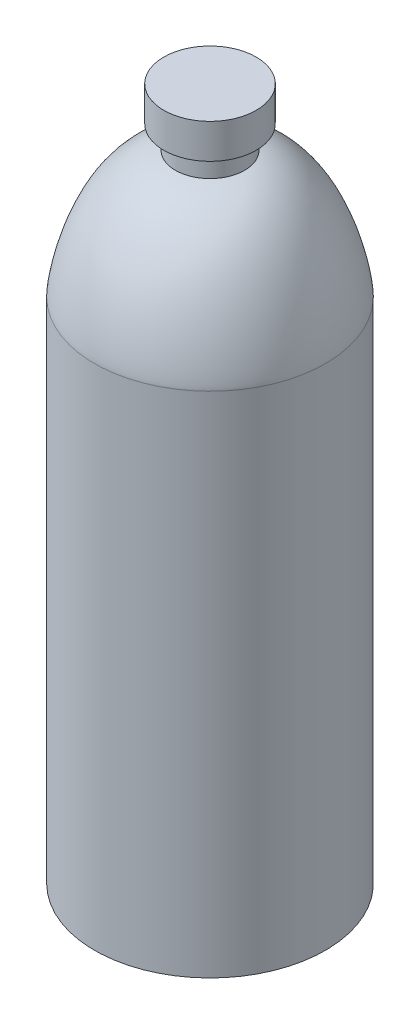
from build123d import *


with BuildPart() as part:
    # Sketch1 → Revolve1 (revolve)
    with BuildSketch(Plane(origin=(0, 0, 0), x_dir=(0, 0, -1), z_dir=(1, 0, 0))):
        with BuildLine():
            Line((0, 95.25), (12.7, 95.25))
            Line((12.7, 95.25), (12.7, 85.725))
            Line((12.7, 85.725), (9.525, 85.725))
            Line((9.525, 85.725), (9.525, 79.375))
            add(Edge.make_bspline(
                [(9.525, 79.375), (27.523263922, 75.474774462), (31.900002123, 46.864796856), (31.75, 44.45)],
                knots=[0, 0, 0, 0, 1, 1, 1, 1], degree=3))
            Line((31.75, 44.45), (31.75, -95.25))
            Line((31.75, -95.25), (0, -95.25))
            Line((0, -95.25), (0, 95.25))
        make_face()
    revolve(axis=Axis((0, -95.25, 0), (0, 1, 0)))


solid = part.part
